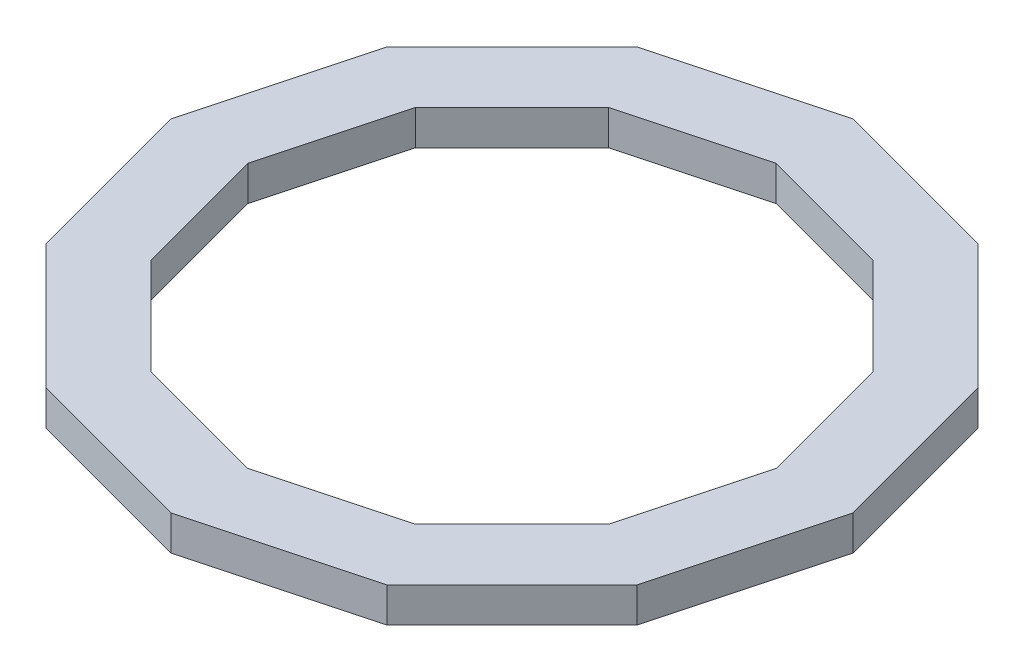
from build123d import *

# Parameters (mm, degrees)
BOSS_EXTRUDE2_DEPTH = 19.05


with BuildPart() as part:
    # Sketch2 → Boss-Extrude2 (new body)
    with BuildSketch(Plane(origin=(0, 0, 0), x_dir=(1, 0, 0), z_dir=(0, 1, 0))):
        Polygon((186.462321507, 0), (161.481107274, 93.231160753), (93.231160753, 161.481107274), (0, 186.462321507), (-93.231160753, 161.481107274), (-161.481107274, 93.231160753), (-186.462321507, 0), (-161.481107274, -93.231160753), (-93.231160753, -161.481107274), (0, -186.462321507), (93.231160753, -161.481107274), (161.481107274, -93.231160753), align=None)
        Polygon((144.388697535, 0), (125.044280085, 72.194348767), (72.194348767, 125.044280085), (0, 144.388697535), (-72.194348767, 125.044280085), (-125.044280085, 72.194348767), (-144.388697535, 0), (-125.044280085, -72.194348767), (-72.194348767, -125.044280085), (0, -144.388697535), (72.194348767, -125.044280085), (125.044280085, -72.194348767), align=None, mode=Mode.SUBTRACT)
    extrude(amount=BOSS_EXTRUDE2_DEPTH)


solid = part.part
